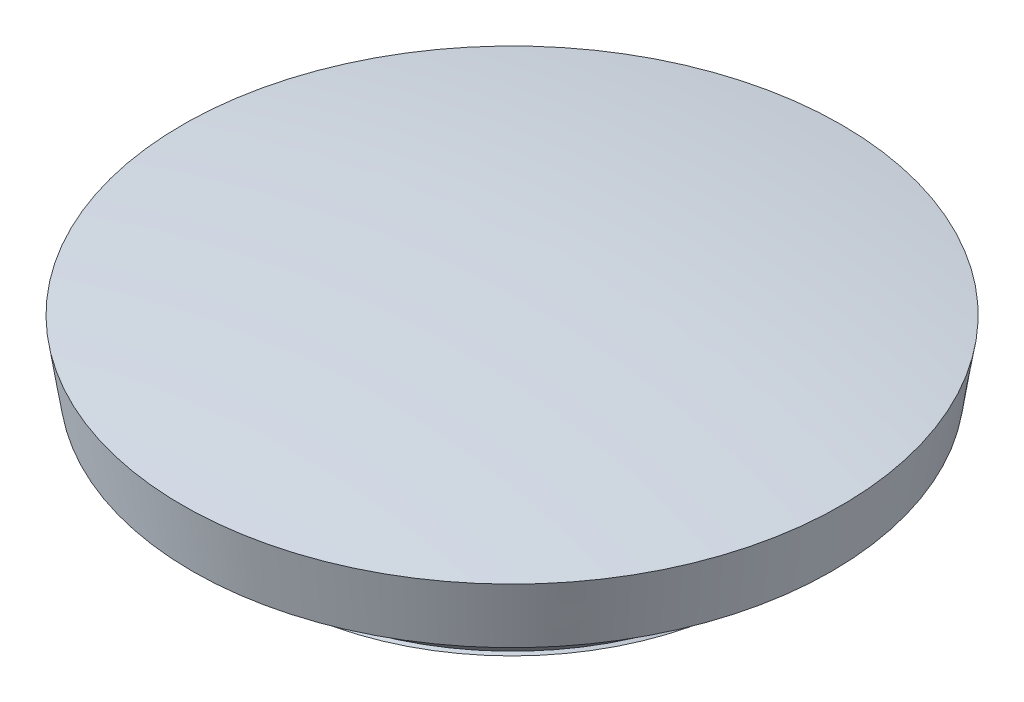
from build123d import *


with BuildPart() as part:
    # gel → Revolve10 (revolve)
    with BuildSketch(Plane(origin=(0, 0, 0), x_dir=(0, 0, -1), z_dir=(1, 0, 0))):
        with BuildLine():
            Line((45.748610472, 319.342063422), (35.681896581, 309.789108636))
            Line((35.681896581, 309.789108636), (36.026073869, 309.426421451))
            add(Edge.make_bspline(
                [(36.026073869, 309.426421451), (35.418599599, 309.864813343), (34.662663334, 310.791334864), (33.338846471, 311.851350637), (32.195604525, 312.857808267), (31.057999633, 313.930026132), (29.744727596, 314.885066904), (28.443843287, 315.773694322), (27.120617871, 316.745495513), (25.67624262, 317.351925715), (24.437086975, 318.116301123), (23.215591182, 318.685644379), (22.140954977, 319.262698861), (21.068588892, 319.694847458), (19.930975074, 320.193493634), (18.837916971, 320.641634287), (17.733867065, 321.01494492), (16.810008216, 321.249118962), (15.911496119, 321.566233217), (14.864343001, 321.911666773), (13.637151846, 322.313021034), (12.181632664, 322.557718535), (10.750690756, 322.85377071), (9.272215479, 323.156322342), (7.693496909, 323.429691693), (5.699030772, 323.815957427), (4.197169533, 323.839631011), (3.296807109, 324.000001326)],
                knots=[0, 0, 0, 0, 0.060955497, 0.097023752, 0.138612849, 0.185723979, 0.224847013, 0.271346916, 0.31492086, 0.358660312, 0.398942406, 0.433935796, 0.468925884, 0.498724619, 0.528515026, 0.570655164, 0.595402325, 0.623879931, 0.648625043, 0.673368363, 0.714214895, 0.754112569, 0.794010196, 0.833908612, 0.877650512, 0.925245481, 1, 1, 1, 1], degree=3))
            Line((3.296807109, 324.000001326), (0, 324))
            Line((0, 324), (0, 332))
            ThreePointArc((0, 332), (24.81742663, 331.071133347), (49.495985309, 328.289730936))
            Line((49.495985309, 328.289730936), (48.021369991, 318.979376237))
            Line((48.021369991, 318.979376237), (46.09278776, 318.979376237))
            Line((46.09278776, 318.979376237), (45.748610472, 319.342063422))
        make_face()
    revolve(axis=Axis((0, 0, 0), (0, 1, 0)))


solid = part.part
